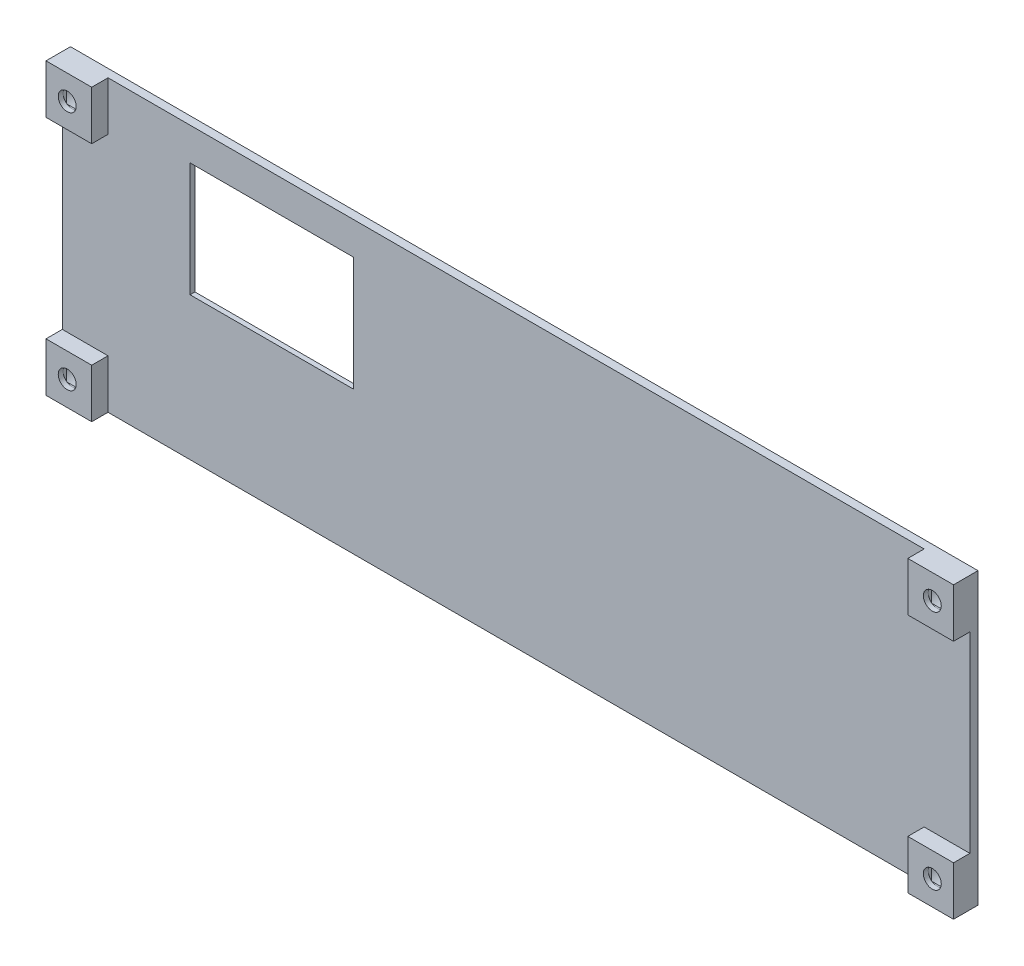
from build123d import *
from build123d.topology import SkipClean

# Parameters (mm, degrees)
SKETCH1_W               = 112
SKETCH1_H               = 35.5
BOSS_EXTRUDE1_DEPTH     = 1
SKETCH2_W               = 6
SKETCH2_H               = 6
BOSS_EXTRUDE2_DEPTH     = 2
SKETCH3_R               = 1.1
CUT_EXTRUDE1_DEPTH      = 59.822295943
SKETCH4_R               = 2
CUT_EXTRUDE2_DEPTH      = 2
SKETCH5_W               = 20
SKETCH5_H               = 14
CUT_EXTRUDE3_DEPTH      = 59.822295943
CHAMFER1_SIZE           = 0.4
CUT_EXTRUDE4_DEPTH      = 0.2
SKETCH7_W               = 2.2
SKETCH7_H               = 2.2
CUT_EXTRUDE5_DEPTH      = 0.2
MIRROR2_COPY_1_DEPTH    = 0.2
MIRROR2_COPY_2_SKETCH_W = 2.2
MIRROR2_COPY_2_SKETCH_H = 2.2
MIRROR2_COPY_2_DEPTH    = 0.2
CUT_EXTRUDE6_DEPTH      = 59.779779687
CUT_EXTRUDE6_DEPTH_BACK = 59.779779687
SKETCH8_W               = 0.4
SKETCH8_H               = 35.5


with BuildPart() as part:
    # Sketch1 → Boss-Extrude1 (new body)
    with BuildSketch(Plane.XY):
        Rectangle(SKETCH1_W, SKETCH1_H)
    extrude(amount=BOSS_EXTRUDE1_DEPTH)

    # Sketch2 → Boss-Extrude2 (add)
    with BuildSketch(Plane.XY.offset(1)):
        with Locations((-53, 14.75)):
            Rectangle(SKETCH2_W, SKETCH2_H)
        with Locations((-53, -14.75)):
            Rectangle(SKETCH2_W, SKETCH2_H)
        with Locations((53, -14.75)):
            Rectangle(SKETCH2_W, SKETCH2_H)
        with Locations((53, 14.75)):
            Rectangle(SKETCH2_W, SKETCH2_H)
    extrude(amount=BOSS_EXTRUDE2_DEPTH)

    # Sketch3 → Cut-Extrude1 (cut, through all)
    with BuildSketch(Plane.XY.offset(3)):
        with Locations((-53, 14.75)):
            Circle(SKETCH3_R)
        with Locations(Location((-53, -14.75, 0), (0, 0, 180))):
            Circle(SKETCH3_R)
        with Locations((53, -14.75)):
            Circle(SKETCH3_R)
        with Locations(Location((53, 14.75, 0), (0, 0, 180))):
            Circle(SKETCH3_R)
    extrude(amount=-CUT_EXTRUDE1_DEPTH, mode=Mode.SUBTRACT)

    # Sketch4 → Cut-Extrude2 (cut)
    with BuildSketch(Plane(origin=(0, 0, 0), x_dir=(-1, 0, 0), z_dir=(0, 0, -1))):
        with Locations((-53, 14.75)):
            Circle(SKETCH4_R)
        with Locations((-53, -14.75)):
            Circle(SKETCH4_R)
        with Locations((53, 14.75)):
            Circle(SKETCH4_R)
        with Locations((53, -14.75)):
            Circle(SKETCH4_R)
    extrude(amount=-CUT_EXTRUDE2_DEPTH, mode=Mode.SUBTRACT)

    # Sketch5 → Cut-Extrude3 (cut, through all)
    with BuildSketch(Plane(origin=(0, 0, 0), x_dir=(-1, 0, 0), z_dir=(0, 0, -1))):
        with Locations((29.95, 6.75)):
            Rectangle(SKETCH5_W, SKETCH5_H)
    extrude(amount=-CUT_EXTRUDE3_DEPTH, mode=Mode.SUBTRACT)

    # Chamfer1
    chamfer1_edges = [part.edges().sort_by_distance(p)[0] for p in [
        (-39.95, 6.75, 0),
        (-29.95, 13.75, 0),
        (-19.95, 6.75, 0),
        (-29.95, -0.25, 0),
    ]]
    chamfer(chamfer1_edges, length=CHAMFER1_SIZE)

    # Sketch6 → Cut-Extrude4 (cut)
    with SkipClean():  # the faces are left unmerged after this step: merging them gives an invalid solid
        with BuildSketch(Plane(origin=(0, 0, 2), x_dir=(-1, 0, 0), z_dir=(0, 0, -1))):
            with BuildLine():
                Line((-54.1, 13.079670691), (-54.1, 16.420329309))
                ThreePointArc((-54.1, 16.420329309), (-53, 16.75), (-51.9, 16.420329309))
                Line((-51.9, 16.420329309), (-51.9, 13.079670691))
                ThreePointArc((-51.9, 13.079670691), (-53, 12.75), (-54.1, 13.079670691))
            make_face()
        cut_extrude4 = extrude(amount=-CUT_EXTRUDE4_DEPTH, mode=Mode.SUBTRACT)

    # Sketch7 → Cut-Extrude5 (cut)
    with SkipClean():  # the faces are left unmerged after this step: merging them gives an invalid solid
        with BuildSketch(Plane(origin=(0, 0, 2.2), x_dir=(-1, 0, 0), z_dir=(0, 0, -1))):
            with Locations((-53, 14.75)):
                Rectangle(SKETCH7_W, SKETCH7_H)
        cut_extrude5 = extrude(amount=-CUT_EXTRUDE5_DEPTH, mode=Mode.SUBTRACT)

    # Mirror1: Cut-Extrude4, Cut-Extrude5 across plane
    with SkipClean():  # the faces are left unmerged after this step: merging them gives an invalid solid
        add(cut_extrude4.mirror(Plane(origin=(0, 0, 0), x_dir=(0, 0, 1), z_dir=(1, 0, 0))), mode=Mode.SUBTRACT)
        add(cut_extrude5.mirror(Plane(origin=(0, 0, 0), x_dir=(0, 0, 1), z_dir=(1, 0, 0))), mode=Mode.SUBTRACT)

    # Mirror2: Cut-Extrude4, Cut-Extrude5 across plane
    with SkipClean():  # the faces are left unmerged after this step: merging them gives an invalid solid
        add(cut_extrude4.mirror(Plane.ZX), mode=Mode.SUBTRACT)
        add(cut_extrude5.mirror(Plane.ZX), mode=Mode.SUBTRACT)

    # Mirror2 copy 1 sketch → Mirror2 copy 1 (cut)
    with SkipClean():  # the faces are left unmerged after this step: merging them gives an invalid solid
        with BuildSketch(Plane(origin=(0, 0, 2), x_dir=(1, 0, 0), z_dir=(0, 0, -1))):
            with BuildLine():
                Line((-54.1, 13.079670691), (-54.1, 16.420329309))
                ThreePointArc((-54.1, 16.420329309), (-53, 16.75), (-51.9, 16.420329309))
                Line((-51.9, 16.420329309), (-51.9, 13.079670691))
                ThreePointArc((-51.9, 13.079670691), (-53, 12.75), (-54.1, 13.079670691))
            make_face()
        extrude(amount=-MIRROR2_COPY_1_DEPTH, mode=Mode.SUBTRACT)

    # Mirror2 copy 2 sketch → Mirror2 copy 2 (cut)
    with SkipClean():  # the faces are left unmerged after this step: merging them gives an invalid solid
        with BuildSketch(Plane(origin=(0, 0, 2.2), x_dir=(1, 0, 0), z_dir=(0, 0, -1))):
            with Locations((-53, 14.75)):
                Rectangle(MIRROR2_COPY_2_SKETCH_W, MIRROR2_COPY_2_SKETCH_H)
        extrude(amount=-MIRROR2_COPY_2_DEPTH, mode=Mode.SUBTRACT)

    # Sketch8 → Cut-Extrude6 (cut, two sides: drawn at the far end of the back side and taken through both)
    with SkipClean():  # the faces are left unmerged after this step: merging them gives an invalid solid
        with BuildSketch(Plane.XY.offset(1).offset(-CUT_EXTRUDE6_DEPTH_BACK)):
            with Locations((-55.8, 0)):
                Rectangle(SKETCH8_W, SKETCH8_H)
            with Locations((55.8, 0)):
                Rectangle(SKETCH8_W, SKETCH8_H)
        extrude(amount=CUT_EXTRUDE6_DEPTH + CUT_EXTRUDE6_DEPTH_BACK, mode=Mode.SUBTRACT)


solid = part.part
